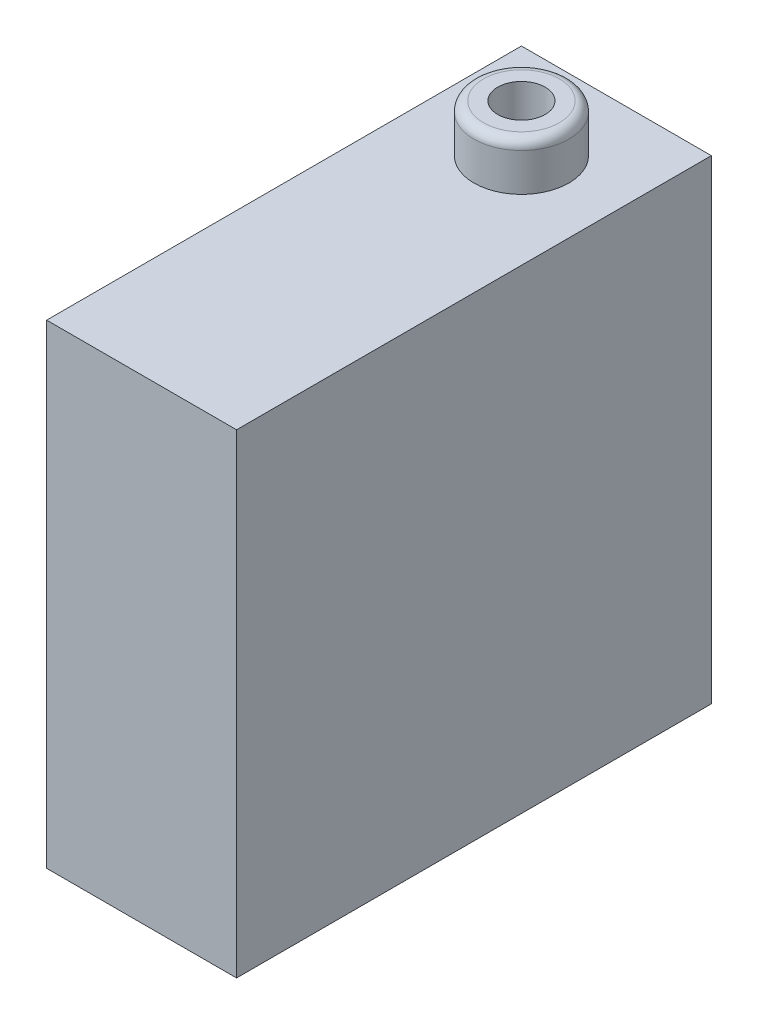
from build123d import *

# Parameters (mm, degrees)
SKETCH1_W           = 20
SKETCH1_H           = 50
BOSS_EXTRUDE1_DEPTH = 50
SKETCH2_R           = 5
BOSS_EXTRUDE2_DEPTH = 5
SKETCH3_R           = 2.5
CUT_EXTRUDE1_DEPTH  = 5
FILLET1_R           = 1


with BuildPart() as part:
    # Sketch1 → Boss-Extrude1 (new body)
    with BuildSketch(Plane(origin=(0, 0, 0), x_dir=(1, 0, 0), z_dir=(0, 1, 0))):
        Rectangle(SKETCH1_W, SKETCH1_H)
    extrude(amount=BOSS_EXTRUDE1_DEPTH)

    # Sketch2 → Boss-Extrude2 (add)
    with BuildSketch(Plane(origin=(0, 50, 0), x_dir=(1, 0, 0), z_dir=(0, 1, 0))):
        with Locations(Location((0, 15, 0), (0, 0, 270))):
            Circle(SKETCH2_R)
    extrude(amount=BOSS_EXTRUDE2_DEPTH)

    # Sketch3 → Cut-Extrude1 (cut)
    with BuildSketch(Plane(origin=(0, 55, 0), x_dir=(1, 0, 0), z_dir=(0, 1, 0))):
        with Locations(Location((0, 15, 0), (0, 0, 270))):
            Circle(SKETCH3_R)
    extrude(amount=-CUT_EXTRUDE1_DEPTH, mode=Mode.SUBTRACT)

    # Fillet1
    fillet1_edges = [part.edges().sort_by_distance(p)[0] for p in [
        (0, 55, -20),
    ]]
    fillet(fillet1_edges, radius=FILLET1_R)


solid = part.part
